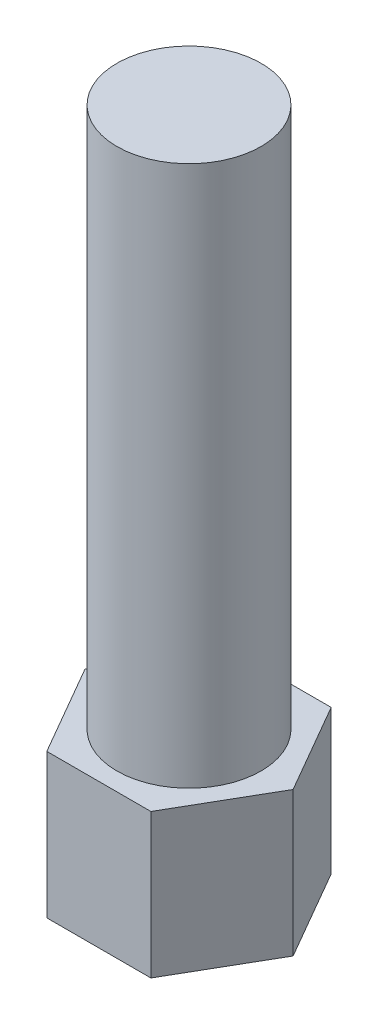
from build123d import *

# Parameters (mm, degrees)
BOSS_EXTRUDE1_DEPTH = 4
SKETCH2_R           = 2
BOSS_EXTRUDE2_DEPTH = 15


with BuildPart() as part:
    # Sketch1 → Boss-Extrude1 (new body)
    with BuildSketch(Plane(origin=(0, 0, 0), x_dir=(1, 0, 0), z_dir=(0, 1, 0))):
        Polygon((2.886751346, 0), (1.443375673, 2.5), (-1.443375673, 2.5), (-2.886751346, 0), (-1.443375673, -2.5), (1.443375673, -2.5), align=None)
    extrude(amount=BOSS_EXTRUDE1_DEPTH)

    # Sketch2 → Boss-Extrude2 (add)
    with BuildSketch(Plane(origin=(0, 4, 0), x_dir=(1, 0, 0), z_dir=(0, 1, 0))):
        with Locations(Location((0, 0, 0), (0, 0, 270))):
            Circle(SKETCH2_R)
    extrude(amount=BOSS_EXTRUDE2_DEPTH)


solid = part.part
